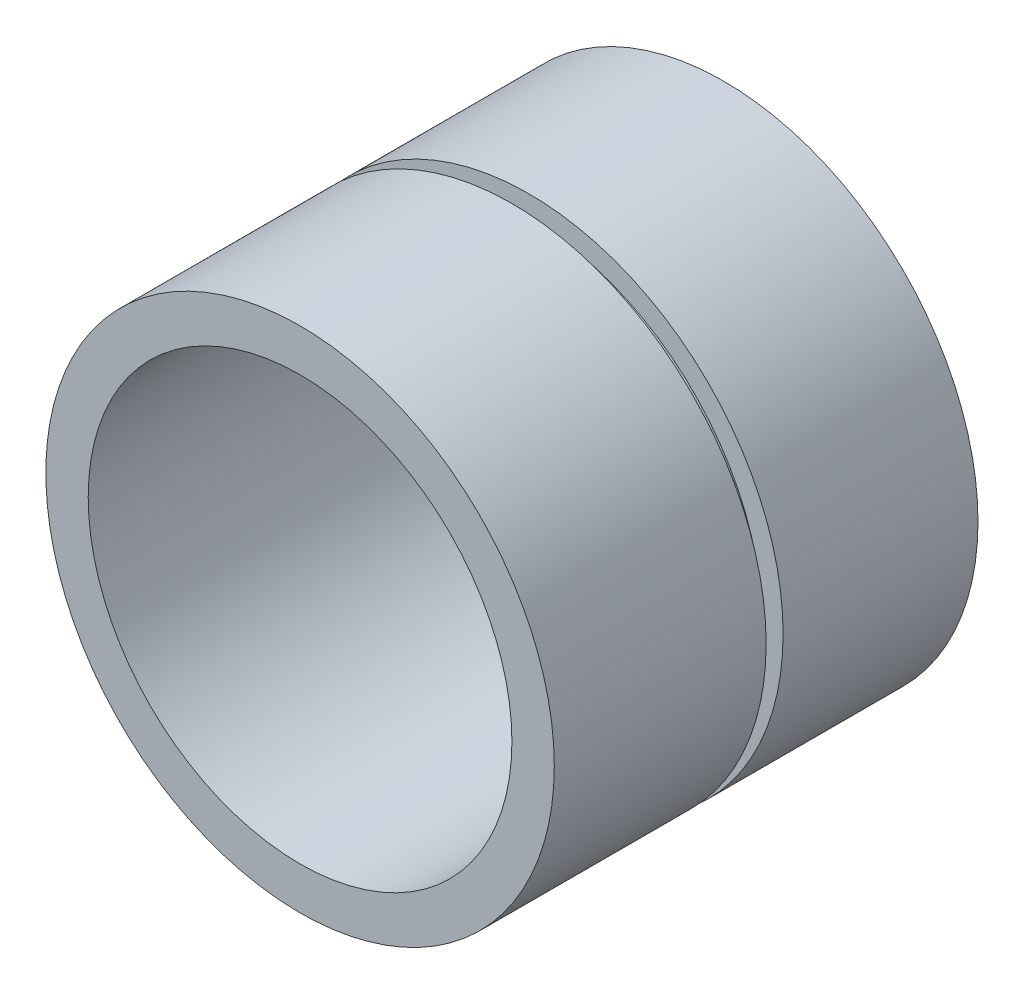
from build123d import *

# Parameters (mm, degrees)
SKETCH_1_R          = 3
EXTRUDE_1_DEPTH     = 5
SKETCH_2_R          = 2.5
CUT_EXTRUDE_1_DEPTH = 5
CUT_EXTRUDE_START   = -0.2
SKETCH_3_R          = 3
SKETCH_3_R_2        = 2.75
CUT_EXTRUDE_2_DEPTH = 0.2


with BuildPart() as part:
    # 草图1 → 凸台-拉伸1 (new body)
    with BuildSketch(Plane.XY):
        Circle(SKETCH_1_R)
    extrude(amount=EXTRUDE_1_DEPTH)

    # 草图2 → 切除-拉伸1 (cut)
    with BuildSketch(Plane(origin=(0, 0, 0), x_dir=(-1, 0, 0), z_dir=(0, 0, -1))):
        Circle(SKETCH_2_R)
    extrude(amount=-CUT_EXTRUDE_1_DEPTH, mode=Mode.SUBTRACT)

    # 草图3 → 切除-拉伸2 (cut)
    with BuildSketch(Plane.XY.offset(2.5).offset(CUT_EXTRUDE_START)):
        Circle(SKETCH_3_R)
        Circle(SKETCH_3_R_2, mode=Mode.SUBTRACT)
    extrude(amount=CUT_EXTRUDE_2_DEPTH, mode=Mode.SUBTRACT)


solid = part.part
